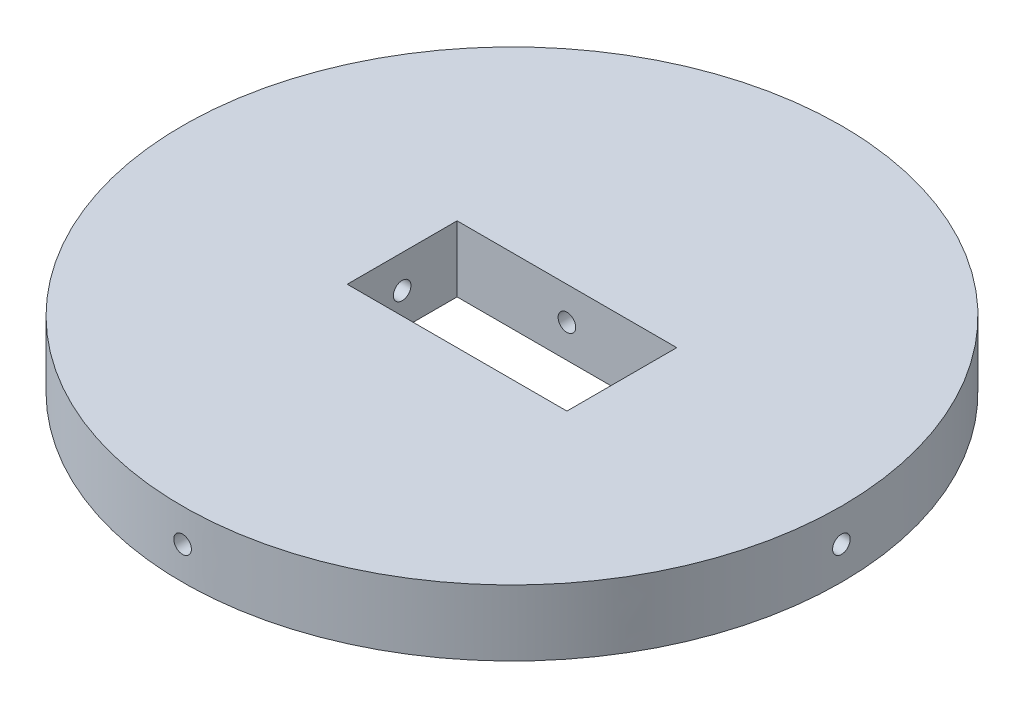
from build123d import *

# Parameters (mm, degrees)
SKETCH_1_RX              = 300
SKETCH_1_RY              = 300
SKETCH_1_R               = 50
EXTRUDE_1_DEPTH          = 60
CUT_EXTRUDE_1_DEPTH      = 429.485705713
CUT_EXTRUDE_1_DEPTH_BACK = 429.485705713
CUT_EXTRUDE_2_DEPTH      = 429.485705867
CUT_EXTRUDE_2_DEPTH_BACK = 429.485705867
SKETCH_4_W               = 200
SKETCH_4_H               = 100
CUT_EXTRUDE_3_DEPTH      = 429.485705867


with BuildPart() as part:
    # 草图1 → 凸台-拉伸1 (new body)
    with BuildSketch(Plane(origin=(0, 0, 0), x_dir=(1, 0, 0), z_dir=(0, 1, 0))):
        with Locations((0, 0)):
            Ellipse(SKETCH_1_RX, SKETCH_1_RY)
        with Locations(Location((0, 0, 0), (0, 0, 270))):
            Circle(SKETCH_1_R, mode=Mode.SUBTRACT)
    extrude(amount=EXTRUDE_1_DEPTH)

    # 草图2 → 切除-拉伸1 (cut, two sides: drawn at the far end of the back side and taken through both)
    with BuildSketch(Plane.XY.offset(-CUT_EXTRUDE_1_DEPTH_BACK)):
        with BuildLine():
            ThreePointArc((0, 38), (-8, 30), (0, 22))
            Line((0, 22), (0, 38))
        make_face()
        with BuildLine():
            Line((0, 38), (0, 22))
            ThreePointArc((0, 22), (5.656854249, 24.343145751), (8, 30))
            ThreePointArc((8, 30), (5.656854249, 35.656854249), (0, 38))
        make_face()
        with BuildLine():
            ThreePointArc((0, 38), (-8, 30), (0, 22))
            Line((0, 22), (0, 38))
        make_face()
        with BuildLine():
            Line((0, 38), (0, 22))
            ThreePointArc((0, 22), (5.656854249, 24.343145751), (8, 30))
            ThreePointArc((8, 30), (5.656854249, 35.656854249), (0, 38))
        make_face()
    extrude(amount=CUT_EXTRUDE_1_DEPTH + CUT_EXTRUDE_1_DEPTH_BACK, mode=Mode.SUBTRACT)

    # 草图3 → 切除-拉伸2 (cut, two sides: drawn at the far end of the back side and taken through both)
    with BuildSketch(Plane(origin=(0, 0, 0), x_dir=(0, 0, -1), z_dir=(1, 0, 0)).offset(-CUT_EXTRUDE_2_DEPTH_BACK)):
        with BuildLine():
            ThreePointArc((0, 38), (-8, 30), (0, 22))
            Line((0, 22), (0, 38))
        make_face()
        with BuildLine():
            Line((0, 38), (0, 22))
            ThreePointArc((0, 22), (5.656854249, 24.343145751), (8, 30))
            ThreePointArc((8, 30), (5.656854249, 35.656854249), (0, 38))
        make_face()
        with BuildLine():
            ThreePointArc((0, 38), (-8, 30), (0, 22))
            Line((0, 22), (0, 38))
        make_face()
        with BuildLine():
            Line((0, 38), (0, 22))
            ThreePointArc((0, 22), (5.656854249, 24.343145751), (8, 30))
            ThreePointArc((8, 30), (5.656854249, 35.656854249), (0, 38))
        make_face()
    extrude(amount=CUT_EXTRUDE_2_DEPTH + CUT_EXTRUDE_2_DEPTH_BACK, mode=Mode.SUBTRACT)

    # 草图4 → 切除-拉伸3 (cut, through all)
    with BuildSketch(Plane(origin=(0, 60, 0), x_dir=(1, 0, 0), z_dir=(0, 1, 0))):
        Rectangle(SKETCH_4_W, SKETCH_4_H)
    extrude(amount=-CUT_EXTRUDE_3_DEPTH, mode=Mode.SUBTRACT)


solid = part.part
